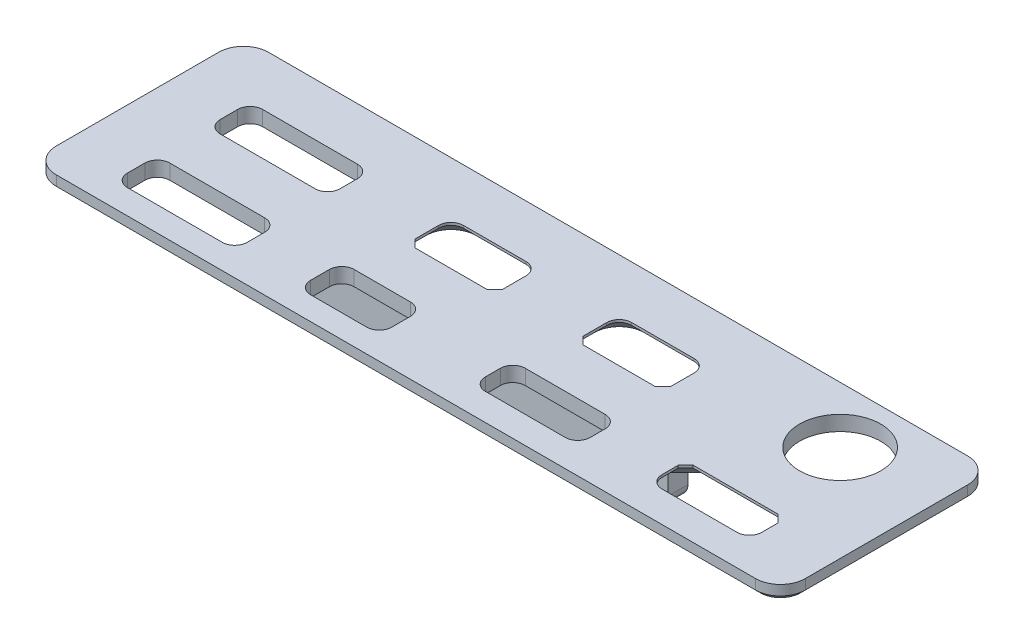
from build123d import *

# Parameters (mm, degrees)
SKETCH_1_W          = 60
SKETCH_1_H          = 17
EXTRUDE_1_DEPTH     = 1.2
CUT_EXTRUDE_1_REACH = 33.204
SKETCH_4_R          = 3.25
SKETCH_4_W          = 9.6
SKETCH_4_H          = 3.4
SKETCH_4_W_2        = 7
SKETCH_4_H_2        = 3.5
SKETCH_4_W_3        = 8
SKETCH_4_H_3        = 2.9
SKETCH_4_W_4        = 8.4
SKETCH_4_H_4        = 3.2
SKETCH_4_W_5        = 6.5
FILLET_2_R          = 1
CHAMFER_1_SIZE      = 0.6
SKETCH_5_W          = 1.5
SKETCH_5_H          = 8
EXTRUDE_2_DEPTH     = 1.2
SKETCH_6_W          = 28.5
SKETCH_6_H          = 1.6
EXTRUDE_3_DEPTH     = 4
FILLET_3_R          = 1
CHAMFER_2_SIZE      = 1
CHAMFER_4_SIZE      = 1
FILLET_4_R          = 2
CHAMFER_5_SIZE      = 0.4


with BuildPart() as part:
    # 草图1 → 凸台-拉伸1 (new body)
    with BuildSketch(Plane(origin=(0, 0, 0), x_dir=(1, 0, 0), z_dir=(0, 1, 0))):
        Rectangle(SKETCH_1_W, SKETCH_1_H)
    extrude(amount=EXTRUDE_1_DEPTH)

    # 草图4 → 切除-拉伸1 (cut, up to next)
    with BuildSketch(Plane(origin=(0, 1.2, 0), x_dir=(1, 0, 0), z_dir=(0, 1, 0)), mode=Mode.PRIVATE) as cut_extrude_1_sk1:
        with Locations(Location((22.298485985, 3.98318929, 0), (0, 0, 270))):
            Circle(SKETCH_4_R)
    cut_extrude_1_tool1 = extrude(cut_extrude_1_sk1.sketch, amount=-CUT_EXTRUDE_1_REACH, mode=Mode.PRIVATE) & part.part
    # 草图4 → 切除-拉伸1 (cut, up to next)
    with BuildSketch(Plane(origin=(0, 1.2, 0), x_dir=(1, 0, 0), z_dir=(0, 1, 0)), mode=Mode.PRIVATE) as cut_extrude_1_sk2:
        with Locations((-20.471722325, 2.6)):
            Rectangle(SKETCH_4_W, SKETCH_4_H)
    cut_extrude_1_tool2 = extrude(cut_extrude_1_sk2.sketch, amount=-CUT_EXTRUDE_1_REACH, mode=Mode.PRIVATE) & part.part
    # 草图4 → 切除-拉伸1 (cut, up to next)
    with BuildSketch(Plane(origin=(0, 1.2, 0), x_dir=(1, 0, 0), z_dir=(0, 1, 0)), mode=Mode.PRIVATE) as cut_extrude_1_sk3:
        with Locations((-5.682926277, 2.55)):
            Rectangle(SKETCH_4_W_2, SKETCH_4_H_2)
    cut_extrude_1_tool3 = extrude(cut_extrude_1_sk3.sketch, amount=-CUT_EXTRUDE_1_REACH, mode=Mode.PRIVATE) & part.part
    # 草图4 → 切除-拉伸1 (cut, up to next)
    with BuildSketch(Plane(origin=(0, 1.2, 0), x_dir=(1, 0, 0), z_dir=(0, 1, 0)), mode=Mode.PRIVATE) as cut_extrude_1_sk4:
        with Locations((7.788485985, 2.55)):
            Rectangle(SKETCH_4_W_2, SKETCH_4_H_2)
    cut_extrude_1_tool4 = extrude(cut_extrude_1_sk4.sketch, amount=-CUT_EXTRUDE_1_REACH, mode=Mode.PRIVATE) & part.part
    # 草图4 → 切除-拉伸1 (cut, up to next)
    with BuildSketch(Plane(origin=(0, 1.2, 0), x_dir=(1, 0, 0), z_dir=(0, 1, 0)), mode=Mode.PRIVATE) as cut_extrude_1_sk5:
        with Locations((21.05, -4.584803861)):
            Rectangle(SKETCH_4_W_3, SKETCH_4_H_3)
    cut_extrude_1_tool5 = extrude(cut_extrude_1_sk5.sketch, amount=-CUT_EXTRUDE_1_REACH, mode=Mode.PRIVATE) & part.part
    # 草图4 → 切除-拉伸1 (cut, up to next)
    with BuildSketch(Plane(origin=(0, 1.2, 0), x_dir=(1, 0, 0), z_dir=(0, 1, 0)), mode=Mode.PRIVATE) as cut_extrude_1_sk6:
        with Locations((7.4, -4.734803861)):
            Rectangle(SKETCH_4_W_4, SKETCH_4_H_4)
    cut_extrude_1_tool6 = extrude(cut_extrude_1_sk6.sketch, amount=-CUT_EXTRUDE_1_REACH, mode=Mode.PRIVATE) & part.part
    # 草图4 → 切除-拉伸1 (cut, up to next)
    with BuildSketch(Plane(origin=(0, 1.2, 0), x_dir=(1, 0, 0), z_dir=(0, 1, 0)), mode=Mode.PRIVATE) as cut_extrude_1_sk7:
        with Locations((-7.25, -4.884803861)):
            Rectangle(SKETCH_4_W_5, SKETCH_4_H_2)
    cut_extrude_1_tool7 = extrude(cut_extrude_1_sk7.sketch, amount=-CUT_EXTRUDE_1_REACH, mode=Mode.PRIVATE) & part.part
    # 草图4 → 切除-拉伸1 (cut, up to next)
    with BuildSketch(Plane(origin=(0, 1.2, 0), x_dir=(1, 0, 0), z_dir=(0, 1, 0)), mode=Mode.PRIVATE) as cut_extrude_1_sk8:
        with Locations((-20.471722325, -4.834803861)):
            Rectangle(SKETCH_4_W, SKETCH_4_H)
    cut_extrude_1_tool8 = extrude(cut_extrude_1_sk8.sketch, amount=-CUT_EXTRUDE_1_REACH, mode=Mode.PRIVATE) & part.part
    add(cut_extrude_1_tool1.solids().sort_by_distance((22.298486, 1.2, -3.983189))[0], mode=Mode.SUBTRACT)
    add(cut_extrude_1_tool2.solids().sort_by_distance((-20.471722, 1.2, -2.6))[0], mode=Mode.SUBTRACT)
    add(cut_extrude_1_tool3.solids().sort_by_distance((-5.682926, 1.2, -2.55))[0], mode=Mode.SUBTRACT)
    add(cut_extrude_1_tool4.solids().sort_by_distance((7.788486, 1.2, -2.55))[0], mode=Mode.SUBTRACT)
    add(cut_extrude_1_tool5.solids().sort_by_distance((21.05, 1.2, 4.584804))[0], mode=Mode.SUBTRACT)
    add(cut_extrude_1_tool6.solids().sort_by_distance((7.4, 1.2, 4.734804))[0], mode=Mode.SUBTRACT)
    add(cut_extrude_1_tool7.solids().sort_by_distance((-7.25, 1.2, 4.884804))[0], mode=Mode.SUBTRACT)
    add(cut_extrude_1_tool8.solids().sort_by_distance((-20.471722, 1.2, 4.834804))[0], mode=Mode.SUBTRACT)

    # 圆角2
    fillet_2_edges = [part.edges().sort_by_distance(p)[0] for p in [
        (-9.182926277, 0.6, -4.3),
        (-2.182926277, 0.6, -4.3),
        (4.288485985, 0.6, -4.3),
        (11.288485985, 0.6, -4.3),
        (17.05, 0.6, 6.034803861),
        (25.05, 0.6, 6.034803861),
        (3.2, 0.6, 6.334803861),
        (3.2, 0.6, 3.134803861),
        (11.6, 0.6, 3.134803861),
        (11.6, 0.6, 6.334803861),
        (-10.5, 0.6, 6.634803861),
        (-10.5, 0.6, 3.134803861),
        (-4, 0.6, 3.134803861),
        (-4, 0.6, 6.634803861),
        (-25.271722325, 0.6, 6.534803861),
        (-25.271722325, 0.6, 3.134803861),
        (-15.671722325, 0.6, 3.134803861),
        (-15.671722325, 0.6, 6.534803861),
        (-25.271722325, 0.6, -0.9),
        (-25.271722325, 0.6, -4.3),
        (-15.671722325, 0.6, -4.3),
        (-15.671722325, 0.6, -0.9),
    ]]
    fillet(fillet_2_edges, radius=FILLET_2_R)

    # 倒角1
    chamfer_1_edges = [part.edges().sort_by_distance(p)[0] for p in [
        (-9.182926277, 0.6, -0.8),
        (-2.182926277, 0.6, -0.8),
        (4.288485985, 0.6, -0.8),
        (11.288485985, 0.6, -0.8),
        (17.05, 0.6, 3.134803861),
        (25.05, 0.6, 3.134803861),
    ]]
    chamfer(chamfer_1_edges, length=CHAMFER_1_SIZE)

    # 草图5 → 凸台-拉伸2 (add)
    with BuildSketch(Plane.XZ):
        with Locations((-13.15891381, 0.61681071)):
            Rectangle(SKETCH_5_W, SKETCH_5_H)
        with Locations((13.84108619, 0.61681071)):
            Rectangle(SKETCH_5_W, SKETCH_5_H)
    extrude(amount=EXTRUDE_2_DEPTH)

    # 草图6 → 凸台-拉伸3 (add)
    with BuildSketch(Plane.XZ):
        with Locations((0.34108619, 1.3)):
            Rectangle(SKETCH_6_W, SKETCH_6_H)
    extrude(amount=EXTRUDE_3_DEPTH)

    # 圆角3
    fillet_3_edges = [part.edges().sort_by_distance(p)[0] for p in [
        (-13.90891381, -4, 1.3),
        (14.59108619, -4, 1.3),
    ]]
    fillet(fillet_3_edges, radius=FILLET_3_R)

    # 倒角2
    chamfer_2_edges = [part.edges().sort_by_distance(p)[0] for p in [
        (-13.15891381, -1.2, -3.38318929),
        (-13.15891381, -1.2, 4.61681071),
        (13.84108619, -1.2, -3.38318929),
        (13.84108619, -1.2, 4.61681071),
    ]]
    chamfer(chamfer_2_edges, length=CHAMFER_2_SIZE)

    # 倒角4
    chamfer_4_edges = [part.edges().sort_by_distance(p)[0] for p in [
        (-5.682926277, 0, -4.3),
        (-2.182926277, 0, -2.35),
        (7.788485985, 0, -4.3),
        (11.288485985, 0, -2.35),
        (21.05, 0, 6.034803861),
        (17.05, 0, 4.384803861),
        (-2.475819496, 0, -4.007106781),
        (-8.890033058, 0, -4.007106781),
        (4.581379204, 0, -4.007106781),
        (10.995592766, 0, -4.007106781),
        (24.757106781, 0, 5.741910642),
        (17.342893219, 0, 5.741910642),
        (-5.682926277, 0, -0.8),
        (-9.182926277, 0, -2.35),
        (7.788485985, 0, -0.8),
        (4.288485985, 0, -2.35),
        (21.05, 0, 3.134803861),
        (25.05, 0, 4.384803861),
        (-8.882926277, 0, -1.1),
        (-2.482926277, 0, -1.1),
        (4.588485985, 0, -1.1),
        (10.988485985, 0, -1.1),
        (17.35, 0, 3.434803861),
        (24.75, 0, 3.434803861),
    ]]
    chamfer(chamfer_4_edges, length=CHAMFER_4_SIZE)

    # 圆角4
    fillet_4_edges = [part.edges().sort_by_distance(p)[0] for p in [
        (30, 0.6, 8.5),
        (-30, 0.6, 8.5),
        (-30, 0.6, -8.5),
        (30, 0.6, -8.5),
    ]]
    fillet(fillet_4_edges, radius=FILLET_4_R)

    # 倒角5
    chamfer_5_edges = [part.edges().sort_by_distance(p)[0] for p in [
        (30, 0, 0),
        (0, 0, 8.5),
        (-30, 0, 0),
        (0, 0, -8.5),
        (-29.414213562, 0, -7.914213562),
        (-29.414213562, 0, 7.914213562),
        (29.414213562, 0, -7.914213562),
        (29.414213562, 0, 7.914213562),
    ]]
    chamfer(chamfer_5_edges, length=CHAMFER_5_SIZE)


solid = part.part
